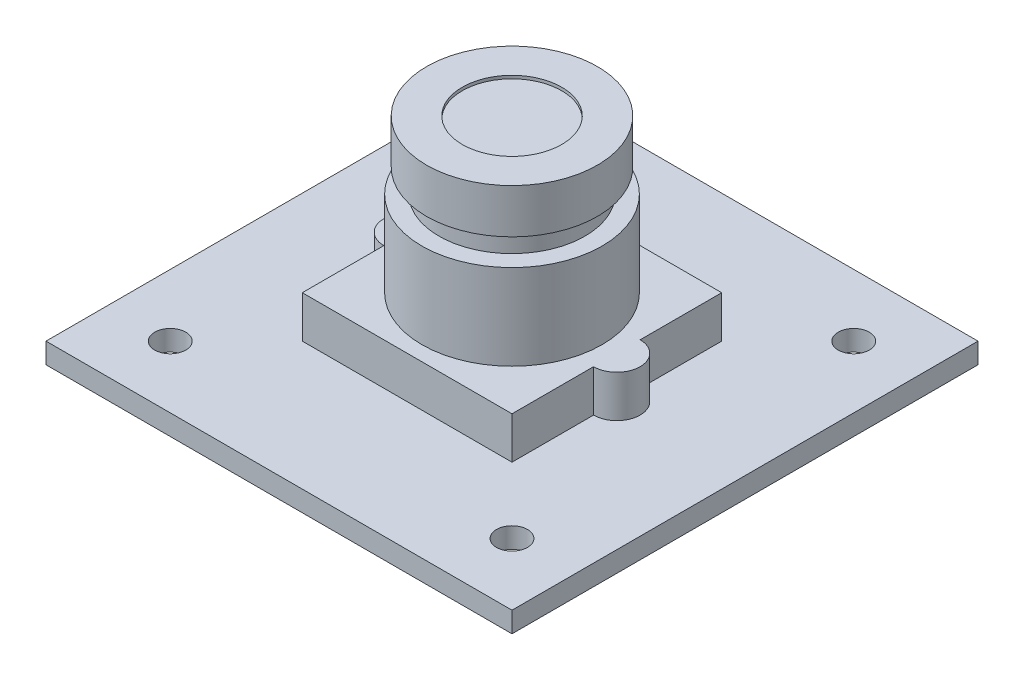
from build123d import *

# Parameters (mm, degrees)
SKETCH1_W           = 38.1
SKETCH1_H           = 38.1
SKETCH1_R           = 1.27
BOSS_EXTRUDE1_DEPTH = 1.6764
BOSS_EXTRUDE2_DEPTH = 3.429
SKETCH3_R           = 7.366
BOSS_EXTRUDE3_DEPTH = 6.985
SKETCH4_R           = 5.969
BOSS_EXTRUDE4_DEPTH = 1.905
SKETCH5_R           = 6.985
BOSS_EXTRUDE5_DEPTH = 3.6322
SKETCH6_R           = 4.064
CUT_EXTRUDE1_DEPTH  = 0.254
SKETCH7_W           = 10.033
SKETCH7_H           = 4.7244
SKETCH7_W_2         = 8.763
SKETCH7_H_2         = 3.4544
BOSS_EXTRUDE6_DEPTH = 6.604
CUT_EXTRUDE2_REACH  = 41.725
SKETCH9_W           = 3.175
SKETCH9_H           = 6.604


with BuildPart() as part:
    # Sketch1 → Boss-Extrude1 (new body)
    with BuildSketch(Plane(origin=(0, 0, 0), x_dir=(1, 0, 0), z_dir=(0, 1, 0))):
        Rectangle(SKETCH1_W, SKETCH1_H)
        with Locations(Location((-13.97, 13.97, 0), (0, 0, 270))):
            Circle(SKETCH1_R, mode=Mode.SUBTRACT)
        with Locations(Location((-13.97, -13.97, 0), (0, 0, 270))):
            Circle(SKETCH1_R, mode=Mode.SUBTRACT)
        with Locations(Location((13.97, -13.97, 0), (0, 0, 270))):
            Circle(SKETCH1_R, mode=Mode.SUBTRACT)
        with Locations(Location((13.97, 13.97, 0), (0, 0, 270))):
            Circle(SKETCH1_R, mode=Mode.SUBTRACT)
    extrude(amount=BOSS_EXTRUDE1_DEPTH)

    # Sketch2 → Boss-Extrude2 (add)
    with BuildSketch(Plane(origin=(0, 1.6764, 0), x_dir=(1, 0, 0), z_dir=(0, 1, 0))):
        with BuildLine():
            Line((-8.5725, -1.905), (-8.5725, -8.5725))
            Line((-8.5725, -8.5725), (8.5725, -8.5725))
            Line((8.5725, -8.5725), (8.5725, -1.905))
            ThreePointArc((8.5725, -1.905), (10.4775, 0), (8.5725, 1.905))
            Line((8.5725, 1.905), (8.5725, 8.5725))
            Line((8.5725, 8.5725), (-8.5725, 8.5725))
            Line((-8.5725, 8.5725), (-8.5725, 1.905))
            ThreePointArc((-8.5725, 1.905), (-10.4775, 0), (-8.5725, -1.905))
        make_face()
    extrude(amount=BOSS_EXTRUDE2_DEPTH)

    # Sketch3 → Boss-Extrude3 (add)
    with BuildSketch(Plane(origin=(0, 5.1054, 0), x_dir=(1, 0, 0), z_dir=(0, 1, 0))):
        with Locations(Location((0, 0, 0), (0, 0, 270))):
            Circle(SKETCH3_R)
    extrude(amount=BOSS_EXTRUDE3_DEPTH)

    # Sketch4 → Boss-Extrude4 (add)
    with BuildSketch(Plane(origin=(0, 12.0904, 0), x_dir=(1, 0, 0), z_dir=(0, 1, 0))):
        with Locations(Location((0, 0, 0), (0, 0, 90))):
            Circle(SKETCH4_R)
    extrude(amount=BOSS_EXTRUDE4_DEPTH)

    # Sketch5 → Boss-Extrude5 (add)
    with BuildSketch(Plane(origin=(0, 13.9954, 0), x_dir=(1, 0, 0), z_dir=(0, 1, 0))):
        with Locations(Location((0, 0, 0), (0, 0, 270))):
            Circle(SKETCH5_R)
    extrude(amount=BOSS_EXTRUDE5_DEPTH)

    # Sketch6 → Cut-Extrude1 (cut)
    with BuildSketch(Plane(origin=(0, 17.6276, 0), x_dir=(1, 0, 0), z_dir=(0, 1, 0))):
        with Locations(Location((0, 0, 0), (0, 0, 270))):
            Circle(SKETCH6_R)
    extrude(amount=-CUT_EXTRUDE1_DEPTH, mode=Mode.SUBTRACT)

    # Sketch7 → Boss-Extrude6 (add)
    with BuildSketch(Plane.XZ):
        with Locations((-5.9055, -13.3858)):
            Rectangle(SKETCH7_W, SKETCH7_H)
        with Locations((-5.9055, -13.3858)):
            Rectangle(SKETCH7_W_2, SKETCH7_H_2, mode=Mode.SUBTRACT)
    extrude(amount=BOSS_EXTRUDE6_DEPTH)

    # Sketch9 → Cut-Extrude2 (cut, up to next)
    with BuildSketch(Plane.XY.offset(-11.0236), mode=Mode.PRIVATE) as cut_extrude2_sk1:
        with Locations((-5.9055, -3.302)):
            Rectangle(SKETCH9_W, SKETCH9_H)
    cut_extrude2_tool1 = extrude(cut_extrude2_sk1.sketch, amount=-CUT_EXTRUDE2_REACH, mode=Mode.PRIVATE) & part.part
    add(cut_extrude2_tool1.solids().sort_by_distance((-5.9055, -3.302, -11.0236))[0], mode=Mode.SUBTRACT)


solid = part.part
